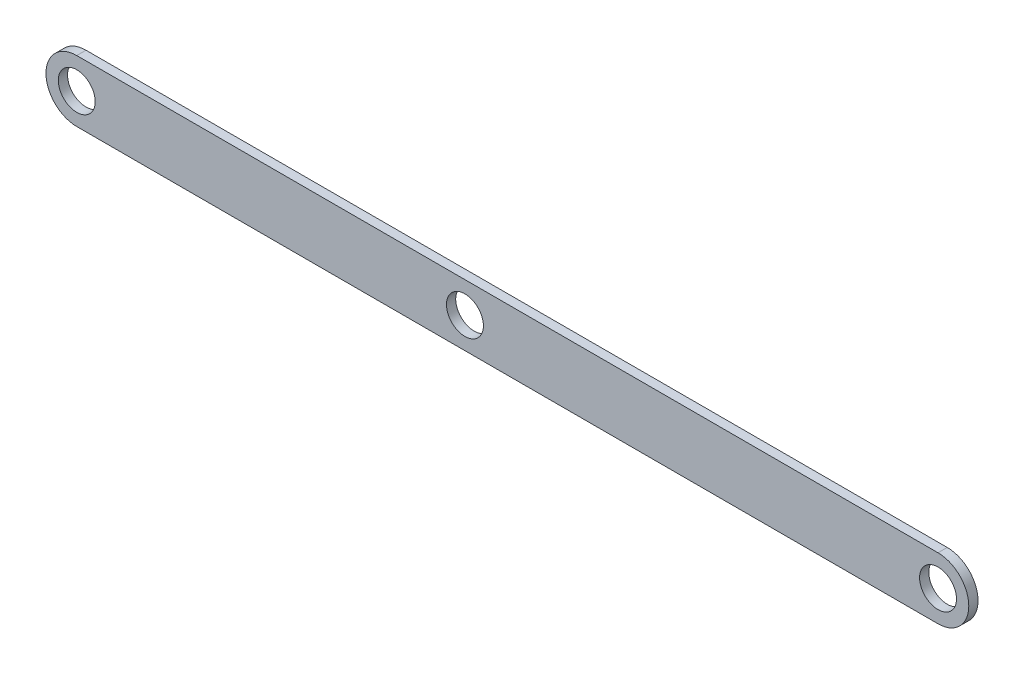
from build123d import *

# Parameters (mm, degrees)
BOSS_EXTRUDE1_DEPTH = 1.5
SKETCH2_R           = 3
CUT_EXTRUDE1_DEPTH  = 146.09393509


with BuildPart() as part:
    # Sketch1 → Boss-Extrude1 (new body)
    with BuildSketch(Plane.XY):
        with BuildLine():
            Line((0, 5), (140, 5))
            ThreePointArc((140, 5), (145, 0), (140, -5))
            Line((140, -5), (0, -5))
            ThreePointArc((0, -5), (-5, 0), (0, 5))
        make_face()
    extrude(amount=BOSS_EXTRUDE1_DEPTH)

    # Sketch2 → Cut-Extrude1 (cut, through all)
    with BuildSketch(Plane.XY.offset(1.5)):
        Circle(SKETCH2_R)
        with Locations((140, 0)):
            Circle(SKETCH2_R)
        with Locations((63.1, 0)):
            Circle(SKETCH2_R)
    extrude(amount=-CUT_EXTRUDE1_DEPTH, mode=Mode.SUBTRACT)


solid = part.part
